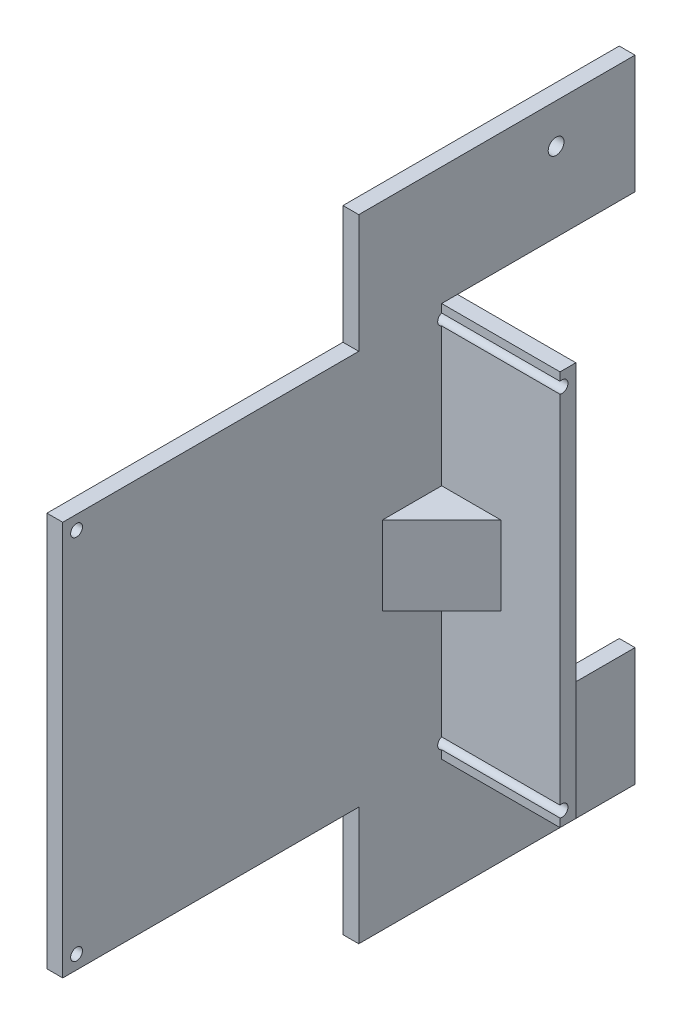
from build123d import *

# Parameters (mm, degrees)
SKETCH_1_W           = 100
SKETCH_1_H           = 100
EXTRUDE_1_DEPTH      = 4
SKETCH_2_W           = 4
SKETCH_2_H           = 100
EXTRUDE_2_DEPTH      = 30
SKETCH_3_W           = 70
SKETCH_3_H           = 30
EXTRUDE_3_DEPTH      = 4
SKETCH_4_R           = 2
CUT_EXTRUDE_1_DEPTH  = 128.769323392
SKETCH_5_R           = 1.5
CUT_EXTRUDE_2_DEPTH  = 129.767231857
EXTRUDE_4_DEPTH      = 10
EXTRUDE_4_DEPTH_BACK = 10


with BuildPart() as part:
    # 草图1 → 凸台-拉伸1 (new body)
    with BuildSketch(Plane(origin=(0, 0, 0), x_dir=(0, 0, -1), z_dir=(1, 0, 0))):
        Rectangle(SKETCH_1_W, SKETCH_1_H)
    extrude(amount=EXTRUDE_1_DEPTH)

    # 草图2 → 凸台-拉伸2 (add)
    with BuildSketch(Plane(origin=(4, 0, 0), x_dir=(0, 0, -1), z_dir=(1, 0, 0))):
        with Locations((48, 0)):
            Rectangle(SKETCH_2_W, SKETCH_2_H)
    extrude(amount=EXTRUDE_2_DEPTH)

    # 草图3 → 凸台-拉伸3 (add)
    with BuildSketch(Plane.ZY):
        with Locations((-60, 65)):
            Rectangle(SKETCH_3_W, SKETCH_3_H)
        with Locations((-60, -65)):
            Rectangle(SKETCH_3_W, SKETCH_3_H)
    extrude(amount=-EXTRUDE_3_DEPTH)

    # 草图4 → 切除-拉伸1 (cut, through all)
    with BuildSketch(Plane(origin=(4, 0, 0), x_dir=(0, 0, -1), z_dir=(1, 0, 0))):
        with Locations((75, 70)):
            Circle(SKETCH_4_R)
        with Locations((75, -70)):
            Circle(SKETCH_4_R)
    extrude(amount=-CUT_EXTRUDE_1_DEPTH, mode=Mode.SUBTRACT)

    # 草图5 → 切除-拉伸2 (cut, through all)
    with BuildSketch(Plane.ZY):
        with Locations((46.5, 46.5)):
            Circle(SKETCH_5_R)
        with Locations((-46.5, 46.5)):
            Circle(SKETCH_5_R)
        with Locations((-46.5, -46.5)):
            Circle(SKETCH_5_R)
        with Locations((46.5, -46.5)):
            Circle(SKETCH_5_R)
    extrude(amount=-CUT_EXTRUDE_2_DEPTH, mode=Mode.SUBTRACT)

    # 草图6 → 凸台-拉伸4 (add, two sides: drawn at the far end of the back side and taken through both)
    with BuildSketch(Plane(origin=(0, 0, 0), x_dir=(1, 0, 0), z_dir=(0, 1, 0)).offset(-EXTRUDE_4_DEPTH_BACK)):
        Polygon((4, 31), (19, 46), (4, 46), align=None)
    extrude(amount=EXTRUDE_4_DEPTH + EXTRUDE_4_DEPTH_BACK)


solid = part.part
